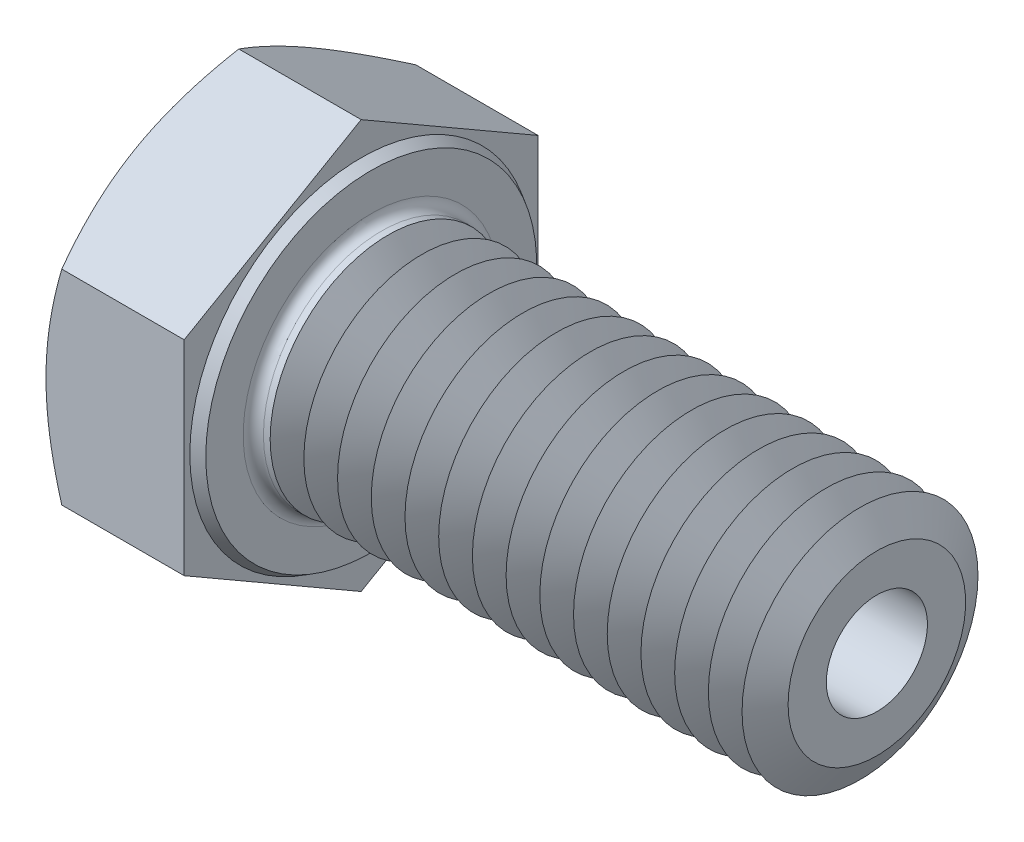
from build123d import *

# Parameters (mm, degrees)
EXTRUDE_421_DEPTH      = 8.8
FILLET_1299_R          = 0.6
PATTERN_LINEAR_1_COUNT = 15
PATTERN_LINEAR_1_PITCH = 2
HOLE_WIZARD_6_0_6_1_D  = 6
M8X1_0_1_D             = 7
M8X1_0_1_DEPTH         = 13
M8X1_0_1_TIP           = 2.103012167


with BuildPart() as part:
    # 草图1 → Extrude 421 (new body)
    with BuildSketch(Plane(origin=(0, 0, 0), x_dir=(0, 0, -1), z_dir=(1, 0, 0))):
        Polygon((10.5, 6.062177826), (10.5, -6.062177826), (0, -12.124355653), (-10.5, -6.062177826), (-10.5, 6.062177826), (0, 12.124355653), align=None)
    extrude(amount=EXTRUDE_421_DEPTH)

    # 草图2 → 凸台-旋转1 (revolve)
    with BuildSketch(Plane.XY, mode=Mode.PRIVATE) as revolve_1_sk:
        Polygon((0, 0), (38.8, 0), (38.8, 5.268), (38.8, 7), (0, 7), align=None)
    revolve(revolve_1_sk.sketch.rotate(Axis((0, 0, 0), (1, 0, 0)), 90), axis=Axis((0, 0, 0), (1, 0, 0)))

    # 草图3 → 切除-旋转1 (revolve, cut)
    with BuildSketch(Plane.XY):
        Polygon((0, 10.5), (3.824573519, 17.124355653), (3.824573519, 22.124355653), (-10, 22.124355653), (-10, 10.5), align=None)
    revolve(axis=Axis((0, 0, 0), (1, 0, 0)), mode=Mode.SUBTRACT)

    # 草图4 → 切除-旋转3 (revolve, cut)
    with BuildSketch(Plane.XY, mode=Mode.PRIVATE) as cut_revolve_3_sk:
        Polygon((8.8, 9.82), (8.2, 10.166410162), (8.2, 12.124355653), (8.8, 12.124355653), align=None)
    revolve(cut_revolve_3_sk.sketch.rotate(Axis((0, 0, 0), (1, 0, 0)), 90), axis=Axis((0, 0, 0), (1, 0, 0)), mode=Mode.SUBTRACT)

    # Fillet 1299
    fillet_1299_edges = [part.edges().sort_by_distance(p)[0] for p in [
        (8.8, 0, -7),
    ]]
    fillet(fillet_1299_edges, radius=FILLET_1299_R)

    # 草图6 → 切除-旋转4 (revolve, cut)
    with BuildSketch(Plane.XY, mode=Mode.PRIVATE) as cut_revolve_4_sk:
        Polygon((37.8, 7), (39.8, 7), (38.8, 5.267949192), align=None)
    cut_revolve_4 = revolve(cut_revolve_4_sk.sketch.rotate(Axis((0, 0, 0), (1, 0, 0)), 90), axis=Axis((0, 0, 0), (1, 0, 0)), mode=Mode.SUBTRACT)

    # 阵列(线性)1: 切除-旋转4 ×15
    with Locations(*[(-i * PATTERN_LINEAR_1_PITCH, 0, 0) for i in range(1, PATTERN_LINEAR_1_COUNT)]):
        add(cut_revolve_4, mode=Mode.SUBTRACT)

    # Ø6.0 (6) 直径孔1 (through all)
    with Locations(Plane(origin=(0, 0, 0), x_dir=(0, 0, -1), z_dir=(-1, 0, 0))):
        with Locations((0, 0)):
            Hole(HOLE_WIZARD_6_0_6_1_D / 2)

    # M8x1.0 螺纹孔1
    with Locations(Plane(origin=(0, 0, 0), x_dir=(0, 0, -1), z_dir=(-1, 0, 0))):
        with Locations((0, 0)):
            Hole(M8X1_0_1_D / 2, depth=M8X1_0_1_DEPTH)
            with Locations((0, 0, -(M8X1_0_1_DEPTH + M8X1_0_1_TIP / 2))):  # 118° drill point
                Cone(0, M8X1_0_1_D / 2, M8X1_0_1_TIP, mode=Mode.SUBTRACT)


solid = part.part
